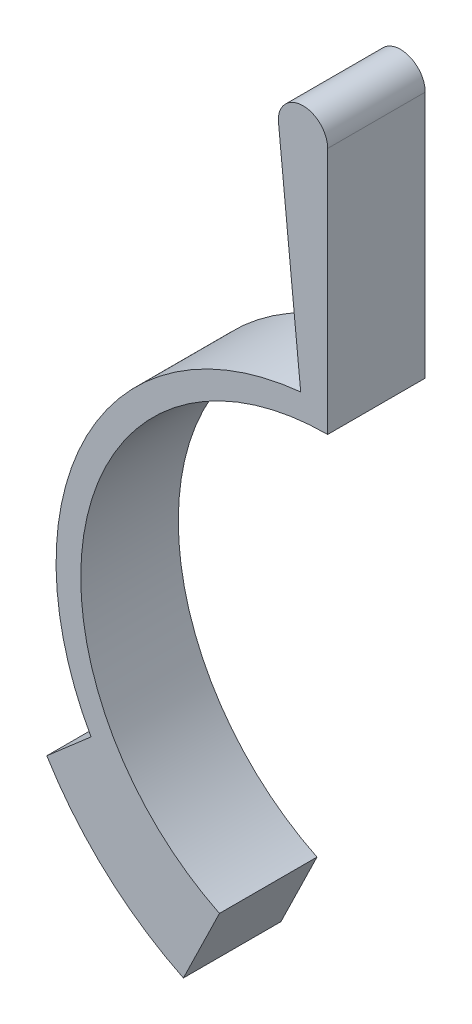
from build123d import *

# Parameters (mm, degrees)
RESSALTO_EXTRUS_O1_DEPTH = 11.849977
ESCALA1_SCALE            = 0.681818182


with BuildPart() as part:
    # Esboço1 → Ressalto-extrusão1 (new body)
    with BuildSketch(Plane.XY):
        with BuildLine():
            ThreePointArc((-10.685745363, -67.703603991), (-26.769323244, -33.991425444), (2.462180193, -10.738217779))
            Line((2.462180193, -10.738217779), (2.462180193, -0.672237217))
            Line((2.462180193, -0.672237217), (2.462180193, 19.360753065))
            ThreePointArc((2.462180193, 19.360753065), (-0.537819807, 22.360753065), (-3.537819807, 19.360753065))
            Line((-3.537819807, 19.360753065), (-3.478607435, 18.767652629))
            Line((-3.478607435, 18.767652629), (-0.816088481, -7.901455538))
            ThreePointArc((-0.816088481, -7.901455538), (-26.821074104, -25.523388901), (-26.291187743, -56.932162089))
            Line((-26.291187743, -56.932162089), (-31.663381791, -61.605561148))
            ThreePointArc((-31.663381791, -61.605561148), (-24.444874339, -70.335690922), (-15.068387215, -76.692066062))
            Line((-15.068387215, -76.692066062), (-10.685745363, -67.703603991))
        make_face()
    extrude(amount=RESSALTO_EXTRUS_O1_DEPTH)


with BuildPart() as part_1:
    # Escala1: scaled about (0, 0, 0)
    add(part.part.scale(ESCALA1_SCALE))


solid = part_1.part
